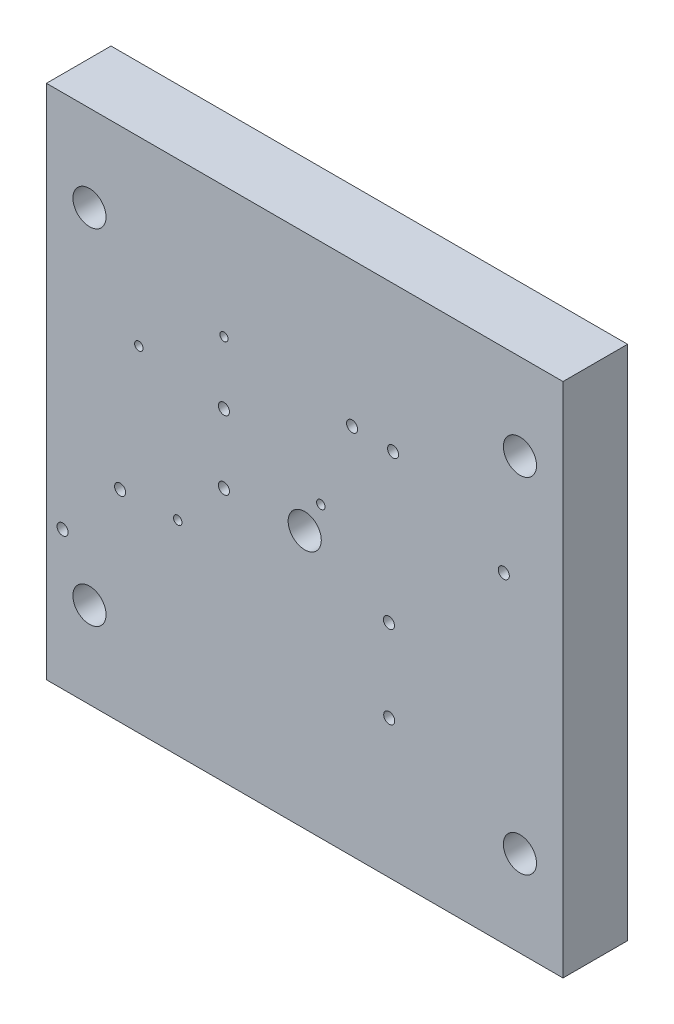
from build123d import *

# Parameters (mm, degrees)
SKETCH1_W                = 304.8
SKETCH1_H                = 304.8
BOSS_EXTRUDE1_DEPTH      = 38.1
SKETCH2_R                = 6.5151
HAAS_T_SLOT_HOLES_DEPTH  = 219.867836833
SKETCH3_R                = 9.779
HAAS_COUNTER_BORES_DEPTH = 22.225
SKETCH4_R                = 3.2639
CUT_EXTRUDE1_DEPTH       = 19.05
SKETCH5_R                = 2.414626773
SKETCH5_R_2              = 2.5
CUT_EXTRUDE2_DEPTH       = 12.7


with BuildPart() as part:
    # Sketch1 → Boss-Extrude1 (new body)
    with BuildSketch(Plane.XY):
        Rectangle(SKETCH1_W, SKETCH1_H)
    extrude(amount=BOSS_EXTRUDE1_DEPTH)

    # Sketch2 → HAAS T-Slot Holes (cut, through all)
    with BuildSketch(Plane.XY.offset(38.1)):
        with Locations((-127, 101.6)):
            Circle(SKETCH2_R)
        with Locations((127, 101.6)):
            Circle(SKETCH2_R)
        with Locations((127, -101.6)):
            Circle(SKETCH2_R)
        with Locations((-127, -101.6)):
            Circle(SKETCH2_R)
        Circle(SKETCH2_R)
    extrude(amount=-HAAS_T_SLOT_HOLES_DEPTH, mode=Mode.SUBTRACT)

    # Sketch3 → HAAS Counter Bores (cut)
    with BuildSketch(Plane.XY.offset(38.1)):
        with Locations((-127, 101.6)):
            Circle(SKETCH3_R)
        with Locations((127, 101.6)):
            Circle(SKETCH3_R)
        Circle(SKETCH3_R)
        with Locations((127, -101.6)):
            Circle(SKETCH3_R)
        with Locations((-127, -101.6)):
            Circle(SKETCH3_R)
    extrude(amount=-HAAS_COUNTER_BORES_DEPTH, mode=Mode.SUBTRACT)

    # Sketch4 → Cut-Extrude1 (cut)
    with BuildSketch(Plane.XY.offset(38.1)):
        with Locations((49.687219878, -22.111676092)):
            Circle(SKETCH4_R)
        with Locations((-108.920281208, -33.388252677)):
            Circle(SKETCH4_R)
        with Locations((-47.636332371, -2.171474357)):
            Circle(SKETCH4_R)
        with Locations((-47.636332371, 38.468525643)):
            Circle(SKETCH4_R)
        with Locations((117.463667629, 37.198525643)):
            Circle(SKETCH4_R)
        with Locations((-142.886332371, -70.751474357)):
            Circle(SKETCH4_R)
        with Locations((49.863146804, -70.751474357)):
            Circle(SKETCH4_R)
        with Locations((27.950841526, 67.306661723)):
            Circle(SKETCH4_R)
        with Locations((52.134639752, 66.47172414)):
            Circle(SKETCH4_R)
    extrude(amount=-CUT_EXTRUDE1_DEPTH, mode=Mode.SUBTRACT)

    # Sketch5 → Cut-Extrude2 (cut)
    with BuildSketch(Plane.XY.offset(38.1)):
        with Locations((-47.636332371, 75.298525643)):
            Circle(SKETCH5_R)
        with Locations((-97.86073036, 45.418148792)):
            Circle(SKETCH5_R_2)
        with Locations((-74.90595552, -32.075872346)):
            Circle(SKETCH5_R_2)
        with Locations((9.513667629, 18.148525643)):
            Circle(SKETCH5_R_2)
    extrude(amount=-CUT_EXTRUDE2_DEPTH, mode=Mode.SUBTRACT)


solid = part.part
